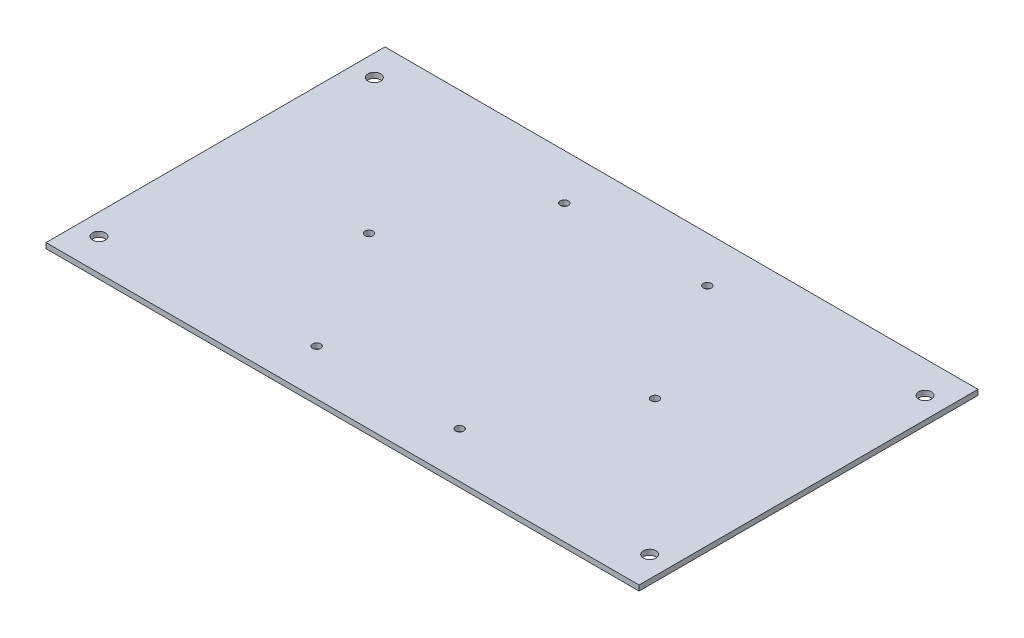
from build123d import *

# Parameters (mm, degrees)
SKETCH1_W           = 355.6
SKETCH1_H           = 203.2
SKETCH1_R           = 2.413
BOSS_EXTRUDE1_DEPTH = 3.175
SKETCH2_R           = 3.81
CUT_EXTRUDE1_DEPTH  = 205.80595847


with BuildPart() as part:
    # Sketch1 → Boss-Extrude1 (new body)
    with BuildSketch(Plane(origin=(0, 0, 0), x_dir=(1, 0, 0), z_dir=(0, 1, 0))):
        Rectangle(SKETCH1_W, SKETCH1_H)
        with Locations(Location((42.8625, 74.240027739, 0), (0, 0, 270))):
            Circle(SKETCH1_R, mode=Mode.SUBTRACT)
        with Locations(Location((85.725, 0, 0), (0, 0, 270))):
            Circle(SKETCH1_R, mode=Mode.SUBTRACT)
        with Locations(Location((42.8625, -74.240027739, 0), (0, 0, 270))):
            Circle(SKETCH1_R, mode=Mode.SUBTRACT)
        with Locations(Location((-42.8625, -74.240027739, 0), (0, 0, 270))):
            Circle(SKETCH1_R, mode=Mode.SUBTRACT)
        with Locations(Location((-85.725, 0, 0), (0, 0, 270))):
            Circle(SKETCH1_R, mode=Mode.SUBTRACT)
        with Locations(Location((-42.8625, 74.240027739, 0), (0, 0, 270))):
            Circle(SKETCH1_R, mode=Mode.SUBTRACT)
    extrude(amount=BOSS_EXTRUDE1_DEPTH)

    # Sketch2 → Cut-Extrude1 (cut, through all)
    with BuildSketch(Plane(origin=(0, 3.175, 0), x_dir=(1, 0, 0), z_dir=(0, 1, 0))):
        with Locations(Location((165.1, 82.55, 0), (0, 0, 270))):
            Circle(SKETCH2_R)
        with Locations(Location((-165.1, 82.55, 0), (0, 0, 90))):
            Circle(SKETCH2_R)
        with Locations(Location((-165.1, -82.55, 0), (0, 0, 270))):
            Circle(SKETCH2_R)
        with Locations(Location((165.1, -82.55, 0), (0, 0, 90))):
            Circle(SKETCH2_R)
    extrude(amount=-CUT_EXTRUDE1_DEPTH, mode=Mode.SUBTRACT)


solid = part.part
